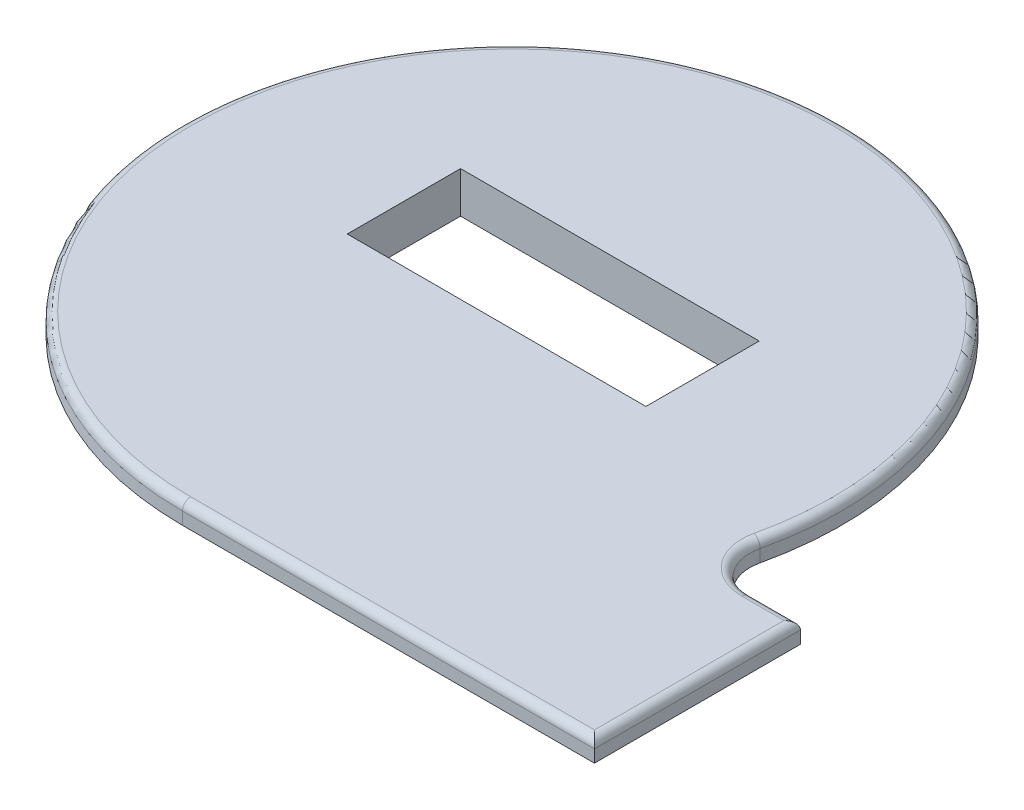
from build123d import *

# Parameters (mm, degrees)
BOSS_EXTRUDE1_DEPTH = 5
BOSS_EXTRUDE2_DEPTH = 5
SKETCH3_W           = 72.5
SKETCH3_H           = 27.5
CUT_EXTRUDE1_DEPTH  = 129.452325787
SKETCH4_R           = 1.5
CUT_EXTRUDE2_DEPTH  = 5
FILLET2_R           = 10
FILLET3_R           = 2
FILLET1_R           = 2


with BuildPart() as part:
    # Sketch1 → Boss-Extrude1 (new body)
    with BuildSketch(Plane(origin=(0, 0, 0), x_dir=(1, 0, 0), z_dir=(0, 1, 0))):
        with BuildLine():
            Line((0, -80), (100, -80))
            Line((100, -80), (100, -30))
            Line((100, -30), (74.161984871, -30))
            ThreePointArc((74.161984871, -30), (-44.72135955, 66.332495807), (0, -80))
        make_face()
    extrude(amount=BOSS_EXTRUDE1_DEPTH)

    # Sketch2 → Boss-Extrude2 (add)
    with BuildSketch(Plane.XZ):
        with BuildLine():
            Line((0, 74.8), (94.8, 74.8))
            Line((94.8, 74.8), (94.8, 35.2))
            Line((94.8, 35.2), (66, 35.2))
            ThreePointArc((66, 35.2), (-38.484282506, -64.140470843), (0, 74.8))
        make_face()
    extrude(amount=BOSS_EXTRUDE2_DEPTH)

    # Sketch3 → Cut-Extrude1 (cut, through all)
    with BuildSketch(Plane(origin=(0, 5, 0), x_dir=(1, 0, 0), z_dir=(0, 1, 0))):
        with Locations((0, 10)):
            Rectangle(SKETCH3_W, SKETCH3_H)
    extrude(amount=-CUT_EXTRUDE1_DEPTH, mode=Mode.SUBTRACT)

    # Sketch4 → Cut-Extrude2 (cut)
    with BuildSketch(Plane.XZ.offset(5)):
        with Locations(Location((-37.5, 5.5, 0), (0, 0, 270))):
            Circle(SKETCH4_R)
        with Locations(Location((37.5, 5.5, 0), (0, 0, 270))):
            Circle(SKETCH4_R)
        with Locations(Location((37.5, -25.5, 0), (0, 0, 270))):
            Circle(SKETCH4_R)
        with Locations(Location((-37.5, -25.5, 0), (0, 0, 270))):
            Circle(SKETCH4_R)
    extrude(amount=-CUT_EXTRUDE2_DEPTH, mode=Mode.SUBTRACT)

    # Fillet2
    fillet2_edges = [part.edges().sort_by_distance(p)[0] for p in [
        (66, -2.5, 35.2),
        (74.161984871, 2.5, 30),
    ]]
    fillet(fillet2_edges, radius=FILLET2_R)

    # Fillet3
    fillet3_edges = [part.edges().sort_by_distance(p)[0] for p in [
        (100, 5, 55),
        (93.874821937, 5, 30),
        (-49.888765157, 5, -62.538876798),
        (79.932284274, 5, 26.236095645),
        (50, 5, 80),
    ]]
    fillet(fillet3_edges, radius=FILLET3_R)

    # Fillet1
    fillet1_edges = [part.edges().sort_by_distance(p)[0] for p in [
        (-44.341645317, -5, -60.240007392),
        (94.8, -5, 55),
        (47.4, -5, 74.8),
        (87.88456496, -5, 35.2),
        (72.915652996, -5, 31.128027449),
    ]]
    fillet(fillet1_edges, radius=FILLET1_R)


solid = part.part
